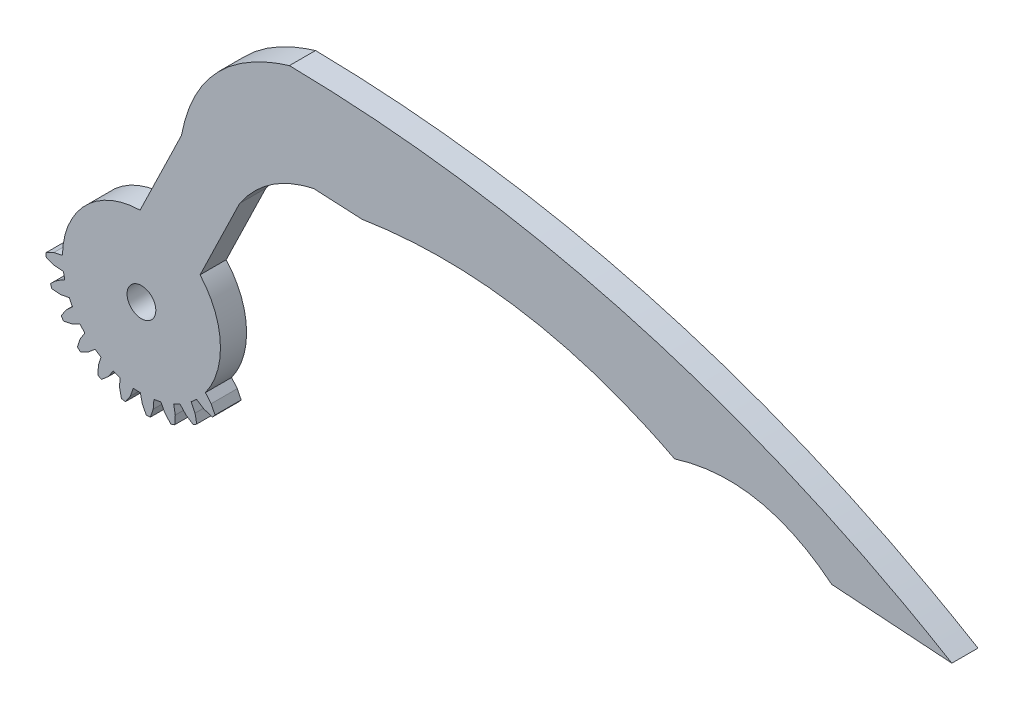
from build123d import *

# Parameters (mm, degrees)
SKETCH1_W           = 150
SKETCH1_H           = 70
BOSS_EXTRUDE2_DEPTH = 4
SKETCH3_W           = 150
SKETCH3_H           = 70
SKETCH3_R           = 2.2
CUT_EXTRUDE2_DEPTH  = 4


with BuildPart() as part:
    # Sketch1 → Boss-Extrude2 (new body)
    with BuildSketch(Plane.XY):
        Rectangle(SKETCH1_W, SKETCH1_H)
    extrude(amount=BOSS_EXTRUDE2_DEPTH)

    # Sketch3 → Cut-Extrude2 (cut)
    # profile 1 of 2: a face of its own
    with BuildSketch(Plane.XY.offset(4)):
        Rectangle(SKETCH3_W, SKETCH3_H)
        with BuildLine():
            Line((-40.048699904, 4.047442221), (-46.108056892, -8.453831345))
            ThreePointArc((-46.108056892, -8.453831345), (-43.005686407, -15.910387786), (-45.28923235, -23.657022831))
            Line((-45.28923235, -23.657022831), (-44.413257795, -24.68114801))
            Line((-44.413257795, -24.68114801), (-43.818150486, -25.890284518))
            Line((-43.818150486, -25.890284518), (-44.226488656, -26.36235802))
            Line((-44.226488656, -26.36235802), (-45.513146968, -25.945538135))
            Line((-45.513146968, -25.945538135), (-46.648345309, -25.228272501))
            Line((-46.648345309, -25.228272501), (-47.459528308, -25.949502265))
            Line((-47.459528308, -25.949502265), (-46.878464963, -27.165450123))
            Line((-46.878464963, -27.165450123), (-46.616583, -28.487411409))
            Line((-46.616583, -28.487411409), (-47.133188997, -28.837713701))
            Line((-47.133188997, -28.837713701), (-48.264395233, -28.105227349))
            Line((-48.264395233, -28.105227349), (-49.178999955, -27.115448583))
            Line((-49.178999955, -27.115448583), (-50.149210562, -27.60215343))
            Line((-50.149210562, -27.60215343), (-49.902656934, -28.927059129))
            Line((-49.902656934, -28.927059129), (-49.991847141, -30.271755716))
            Line((-49.991847141, -30.271755716), (-50.581515119, -30.476414277))
            Line((-50.581515119, -30.476414277), (-51.484595019, -29.476109074))
            Line((-51.484595019, -29.476109074), (-52.111861746, -28.28333908))
            Line((-52.111861746, -28.28333908), (-53.174981712, -28.502350879))
            Line((-53.174981712, -28.502350879), (-53.279740023, -29.845924286))
            Line((-53.279740023, -29.845924286), (-53.713924234, -31.121717324))
            Line((-53.713924234, -31.121717324), (-54.336469297, -31.16678501))
            Line((-54.336469297, -31.16678501), (-54.949879458, -29.966830103))
            Line((-54.949879458, -29.966830103), (-55.247060998, -28.652354186))
            Line((-55.247060998, -28.652354186), (-56.330640455, -28.588747644))
            Line((-56.330640455, -28.588747644), (-56.779571599, -29.859426451))
            Line((-56.779571599, -29.859426451), (-57.529160877, -30.979372753))
            Line((-57.529160877, -30.979372753), (-58.142157607, -30.861778276))
            Line((-58.142157607, -30.861778276), (-58.424095141, -29.543948609))
            Line((-58.424095141, -29.543948609), (-58.370939064, -28.19734613))
            Line((-58.370939064, -28.19734613), (-59.401133862, -27.855455928))
            Line((-59.401133862, -27.855455928), (-60.163643923, -28.966645475))
            Line((-60.163643923, -28.966645475), (-61.177554999, -29.85442255))
            Line((-61.177554999, -29.85442255), (-61.739228681, -29.58217978))
            Line((-61.739228681, -29.58217978), (-61.67048001, -28.236283266))
            Line((-61.67048001, -28.236283266), (-61.270608815, -26.94932296))
            Line((-61.270608815, -26.94932296), (-62.177212881, -26.35244835))
            Line((-62.177212881, -26.35244835), (-63.20133806, -27.228422905))
            Line((-63.20133806, -27.228422905), (-64.410474568, -27.823530214))
            Line((-64.410474568, -27.823530214), (-64.88254807, -27.415192045))
            Line((-64.88254807, -27.415192045), (-64.467798303, -26.132949308))
            Line((-64.467798303, -26.132949308), (-63.748462551, -24.993335391))
            Line((-63.748462551, -24.993335391), (-64.469692315, -24.182152392))
            Line((-64.469692315, -24.182152392), (-65.685640173, -24.763215738))
            Line((-65.685640173, -24.763215738), (-67.007601459, -25.0250977))
            Line((-67.007601459, -25.0250977), (-67.357903751, -24.508491703))
            Line((-67.357903751, -24.508491703), (-66.625417399, -23.377285468))
            Line((-66.625417399, -23.377285468), (-65.635638633, -22.462680745))
            Line((-65.635638633, -22.462680745), (-66.12234348, -21.492470138))
            Line((-66.12234348, -21.492470138), (-67.442381009, -21.7387346))
            Line((-67.442381009, -21.7387346), (-68.791945766, -21.64983356))
            Line((-68.791945766, -21.64983356), (-68.996604326, -21.060165581))
            Line((-68.996604326, -21.060165581), (-68.294889193, -20.381180819))
            Line((-68.294889193, -20.381180819), (-67.482373775, -19.839661539))
            Line((-67.482373775, -19.839661539), (-66.816485533, -19.478186849))
            Line((-66.816485533, -19.478186849), (-67.022540929, -18.466698988))
            Line((-67.022540929, -18.466698988), (-68.366114336, -18.361940677))
            Line((-68.366114336, -18.361940677), (-69.641907373, -17.927756466))
            Line((-69.641907373, -17.927756466), (-69.686975059, -17.305211404))
            Line((-69.686975059, -17.305211404), (-68.487020153, -16.691801242))
            Line((-68.487020153, -16.691801242), (-67.172544236, -16.394619702))
            ThreePointArc((-67.172544236, -16.394619702), (-63.64688388, -8.024989426), (-55.28975466, -4.46979842))
            Line((-55.28975466, -4.46979842), (-48.960156028, 8.589020233))
            add(Edge.make_bspline(
                [(-48.960156028, 8.589020233), (-48.525006522, 10.927165739), (-47.35149279, 14.508267826), (-44.541733346, 18.700915308), (-41.70241199, 21.497827932), (-37.723307758, 24.171360097), (-34.481102631, 25.48662902), (-32.433692057, 26.115600859)],
                knots=[0, 0, 0, 0, 0.280484778, 0.43789933, 0.59054437, 0.747359112, 1, 1, 1, 1], degree=3))
            add(Edge.make_bspline(
                [(-32.433692057, 26.115600859), (-28.448350382, 26.052294796), (-22.388276441, 25.79501109), (-14.18632606, 25.099065372), (-7.980885192, 24.383393074), (-1.110987429, 23.380058501), (5.264634034, 22.218898308), (11.43367036, 20.880453465), (16.402139506, 19.662857342), (22.10004856, 18.109153747), (28.279984557, 16.21636129), (35.058120911, 13.860560362), (41.973959107, 11.177047788), (49.136462176, 8.079253646), (58.345885409, 3.636427486), (64.90236683, 0.015251198), (68.946713794, -2.398269379)],
                knots=[0, 0, 0, 0, 0.11222622, 0.17070992, 0.231734086, 0.288076483, 0.366168217, 0.41414212, 0.465798372, 0.51018096, 0.580417809, 0.647733458, 0.712181991, 0.789246486, 0.867392559, 1, 1, 1, 1], degree=3))
            Line((68.946713794, -2.398269379), (50.562544476, -1.150188957))
            add(Edge.make_bspline(
                [(26.520048265, 3.462013086), (29.293489487, 4.336232341), (33.485930617, 5.05031742), (39.24295286, 4.499555321), (44.670037704, 2.915159356), (48.414632414, 0.591836573), (50.562544476, -1.150188957)],
                knots=[0, 0, 0, 0, 0.341962237, 0.48968945, 0.675604444, 1, 1, 1, 1], degree=3))
            add(Edge.make_bspline(
                [(-21.330405303, 11.302406164), (-17.622374152, 11.890988565), (-11.639608099, 12.429319103), (-3.406309539, 12.197655156), (3.469773129, 11.378136184), (9.934529618, 9.974382339), (17.791223488, 7.5394651), (23.098719892, 5.22837296), (26.520048265, 3.462013086)],
                knots=[0, 0, 0, 0, 0.228338819, 0.364248885, 0.500229999, 0.648901093, 0.76588379, 1, 1, 1, 1], degree=3))
            Line((-21.330405303, 11.302406164), (-28.688467899, 11.676006226))
            add(Edge.make_bspline(
                [(-40.048699904, 4.047442221), (-39.103951171, 5.443155397), (-37.347958886, 7.448598356), (-33.529265799, 10.184902808), (-30.685080402, 11.252838939), (-28.688467899, 11.676006226)],
                knots=[0, 0, 0, 0, 0.360825947, 0.563283509, 1, 1, 1, 1], degree=3))
        make_face(mode=Mode.SUBTRACT)
    # profile 2 of 2: a face of its own
    with BuildSketch(Plane.XY.offset(4)):
        with Locations((-55.080935375, -16.560745325)):
            Circle(SKETCH3_R)
    extrude(amount=-CUT_EXTRUDE2_DEPTH, mode=Mode.SUBTRACT)


solid = part.part
